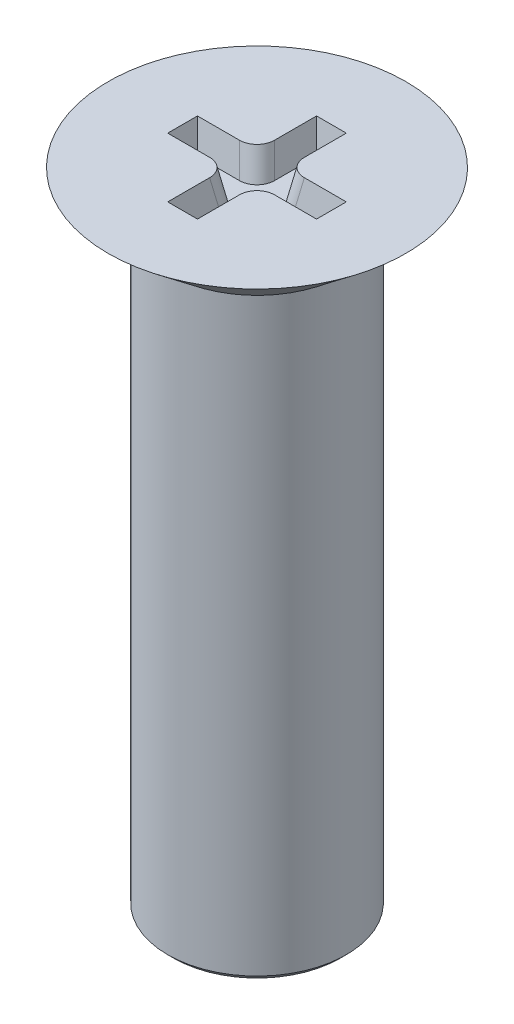
from build123d import *

# Parameters (mm, degrees)
SKETCH_2_R                    = 1.5
EXTRUDE_1_DEPTH               = 10
CHAMFER_1_SIZE                = 0.1
SKETCH_3_W                    = 2.5
SKETCH_3_H                    = 0.5
CUT_EXTRUDE_1_DEPTH           = 0.5
CUT_EXTRUDE_1_DRAFT           = -10
SKETCH_3_W_2                  = 0.5
SKETCH_3_H_2                  = 2.5
CUT_EXTRUDE_1_PROFILE_2_DEPTH = 0.5
CUT_EXTRUDE_1_PROFILE_2_DRAFT = -10
FILLET_1_R                    = 0.3


with BuildPart() as part:
    # 草图1 → 旋转1 (revolve)
    with BuildSketch(Plane.XY, mode=Mode.PRIVATE) as revolve_1_sk:
        Polygon((0, 0), (2.5, 0), (1.5, -0.8), (0, -0.8), align=None)
    revolve(revolve_1_sk.sketch.rotate(Axis((0, -0.8, 0), (0, 1, 0)), 90), axis=Axis((0, -0.8, 0), (0, 1, 0)))

    # 草图2 → 凸台-拉伸1 (add)
    with BuildSketch(Plane.XZ.offset(0.8)):
        with Locations(Location((0, 0, 0), (0, 0, 270))):
            Circle(SKETCH_2_R)
    extrude(amount=EXTRUDE_1_DEPTH)

    # 倒角1
    chamfer_1_edges = [part.edges().sort_by_distance(p)[0] for p in [
        (0, -10.8, 1.5),
    ]]
    chamfer(chamfer_1_edges, length=CHAMFER_1_SIZE)


with BuildPart() as cut_extrude_1_tool:
    # 草图3 → 切除-拉伸1 (with draft: the straight prism first)
    with BuildSketch(Plane(origin=(0, 0, 0), x_dir=(1, 0, 0), z_dir=(0, 1, 0))):
        Rectangle(SKETCH_3_W, SKETCH_3_H)
    extrude(amount=-CUT_EXTRUDE_1_DEPTH)
    # 切除-拉伸1: the draft: its side faces are tilted about the plane it starts from
    cut_extrude_1_sides = [cut_extrude_1_tool.faces().sort_by_distance(p)[0] for p in [
        (0, -0.25, 0.25),
        (1.25, -0.25, 0),
        (0, -0.25, -0.25),
        (-1.25, -0.25, 0),
    ]]
    draft(cut_extrude_1_sides, Plane(origin=(0, 0, 0), x_dir=(1, 0, 0), z_dir=(0, 1, 0)), CUT_EXTRUDE_1_DRAFT)


with BuildPart() as part_1:
    add(part.part)

    # 切除-拉伸1: cut by cut_extrude_1_tool
    add(cut_extrude_1_tool.part, mode=Mode.SUBTRACT)


with BuildPart() as cut_extrude_1_profile_2_tool:
    # 草图3 → 切除-拉伸1 profile 2 (with draft: the straight prism first)
    with BuildSketch(Plane(origin=(0, 0, 0), x_dir=(1, 0, 0), z_dir=(0, 1, 0))):
        Rectangle(SKETCH_3_W_2, SKETCH_3_H_2)
    extrude(amount=-CUT_EXTRUDE_1_PROFILE_2_DEPTH)
    # 切除-拉伸1 profile 2: the draft: its side faces are tilted about the plane it starts from
    cut_extrude_1_profile_2_sides = [cut_extrude_1_profile_2_tool.faces().sort_by_distance(p)[0] for p in [
        (-0.25, -0.25, 0),
        (0, -0.25, 1.25),
        (0.25, -0.25, 0),
        (0, -0.25, -1.25),
    ]]
    draft(cut_extrude_1_profile_2_sides, Plane(origin=(0, 0, 0), x_dir=(1, 0, 0), z_dir=(0, 1, 0)), CUT_EXTRUDE_1_PROFILE_2_DRAFT)


with BuildPart() as part_2:
    add(part_1.part)

    # 切除-拉伸1 profile 2: cut by cut_extrude_1_profile_2_tool
    add(cut_extrude_1_profile_2_tool.part, mode=Mode.SUBTRACT)

    # 圆角1
    fillet_1_edges = [part_2.edges().sort_by_distance(p)[0] for p in [
        (0.205918255, -0.25, -0.205918255),
        (0.205918255, -0.25, 0.205918255),
        (-0.205918255, -0.25, 0.205918255),
        (-0.205918255, -0.25, -0.205918255),
    ]]
    fillet(fillet_1_edges, radius=FILLET_1_R)


solid = part_2.part
